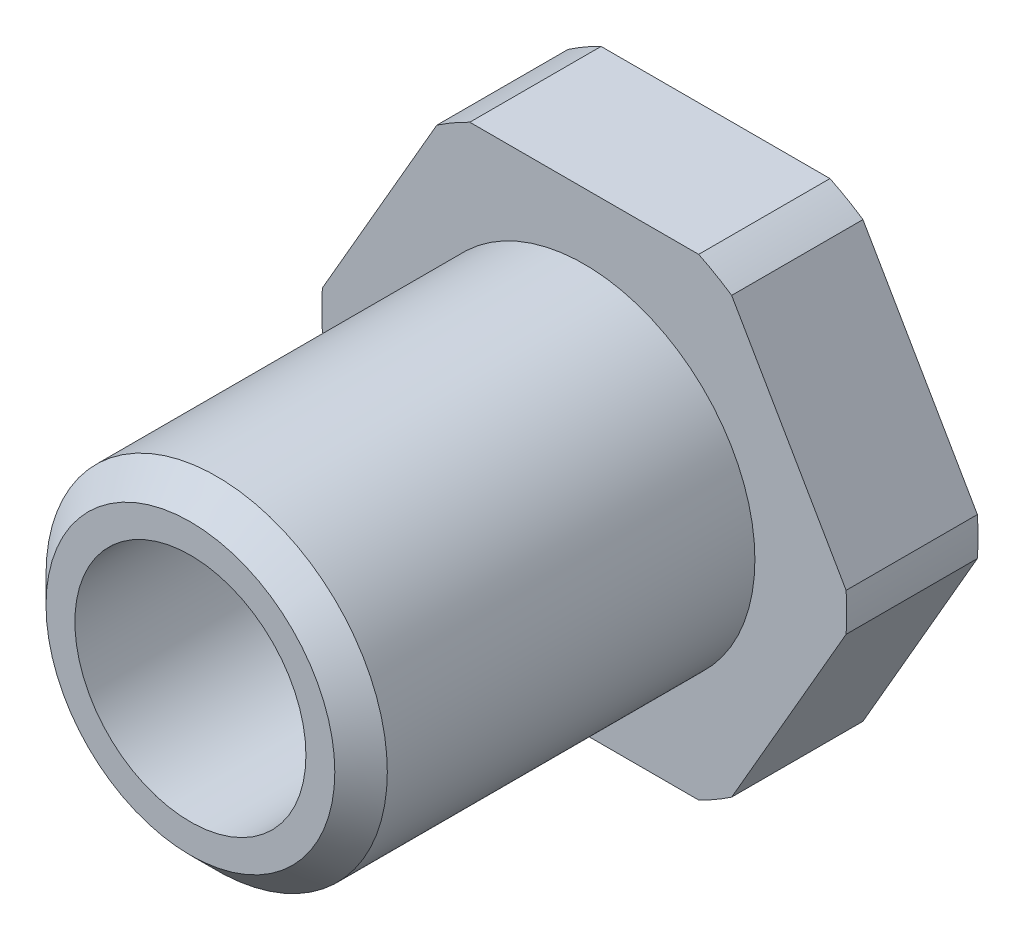
from build123d import *

# Parameters (mm, degrees)
EXTRUDE_1_DEPTH     = 5
SKETCH_2_R          = 6.5
EXTRUDE_2_DEPTH     = 15
SKETCH_5_OUTSIDE_W  = 29.584
SKETCH_5_OUTSIDE_H  = 26.8
SKETCH_5_OUTSIDE_R  = 10
CUT_EXTRUDE_1_DEPTH = 21.346989949
CHAMFER_1_SIZE      = 1
M10X1_25_1_D        = 8.8


with BuildPart() as part:
    # 草图1 → 凸台-拉伸1 (new body)
    with BuildSketch(Plane.XY):
        Polygon((10.392304845, 0), (5.196152423, 9), (-5.196152423, 9), (-10.392304845, 0), (-5.196152423, -9), (5.196152423, -9), align=None)
    extrude(amount=EXTRUDE_1_DEPTH)

    # 草图2 → 凸台-拉伸2 (add)
    with BuildSketch(Plane.XY.offset(5)):
        Circle(SKETCH_2_R)
    extrude(amount=EXTRUDE_2_DEPTH)

    # 草图5 outside → 切除-拉伸1 (cut, through all)
    with BuildSketch(Plane.XY.offset(5)):
        Rectangle(SKETCH_5_OUTSIDE_W, SKETCH_5_OUTSIDE_H)
        Circle(SKETCH_5_OUTSIDE_R, mode=Mode.SUBTRACT)
    extrude(amount=-CUT_EXTRUDE_1_DEPTH, mode=Mode.SUBTRACT)

    # 倒角1
    chamfer_1_edges = [part.edges().sort_by_distance(p)[0] for p in [
        (-6.5, 0, 20),
    ]]
    chamfer(chamfer_1_edges, length=CHAMFER_1_SIZE)

    # M10x1.25 螺纹孔1 (through all)
    with Locations(Plane.XY.offset(20)):
        with Locations((0, 0)):
            Hole(M10X1_25_1_D / 2)


solid = part.part
